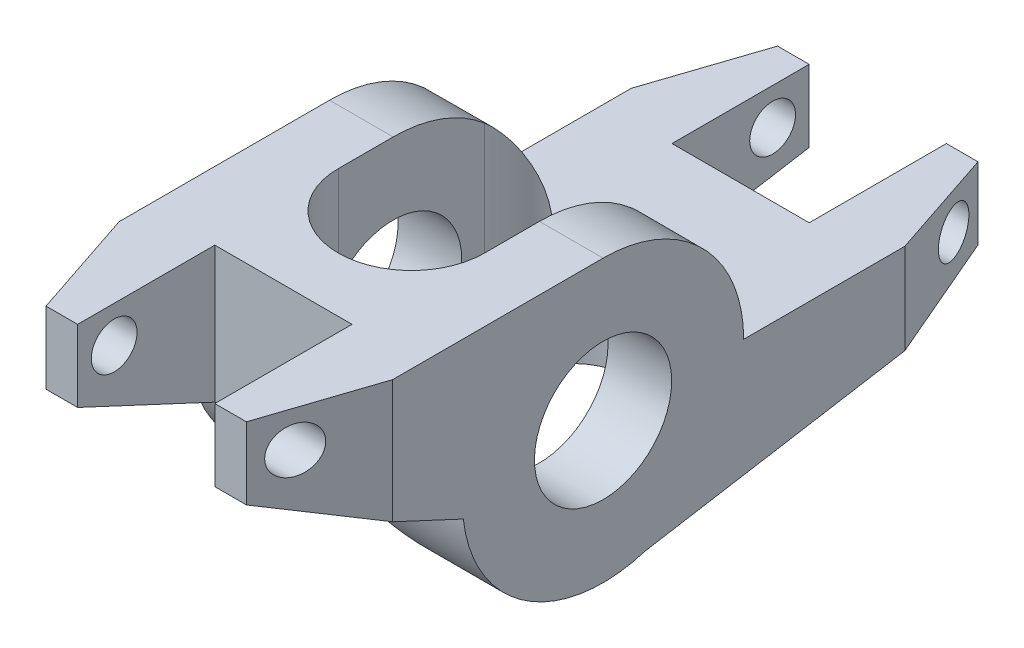
from build123d import *
from OCP.BRepFilletAPI import BRepFilletAPI_MakeChamfer

# Parameters (mm, degrees)
SKETCH1_R               = 4.765
BOSS_EXTRUDE1_DEPTH     = 9.5
CHAMFER1_SIZE           = 2.54
CHAMFER1_SIZE2          = 7.62
CHAMFER2_SIZE           = 7.62
CHAMFER2_SIZE2          = 2.54
CUT_EXTRUDE1_DEPTH      = 32.661042702
CUT_EXTRUDE1_DEPTH_BACK = 32.661042702
CUT_EXTRUDE2_DEPTH      = 32.661042763
CUT_EXTRUDE2_DEPTH_BACK = 32.661042763
SKETCH3_W               = 9.53
SKETCH3_H               = 9.53
CUT_EXTRUDE3_DEPTH      = 32.661042763
CUT_EXTRUDE3_DEPTH_BACK = 32.661042763
SKETCH4_R               = 1.59


with BuildPart() as part:
    # Sketch1 → Boss-Extrude1 (new, symmetric)
    with BuildSketch(Plane(origin=(0, 0, 0), x_dir=(0, 0, -1), z_dir=(1, 0, 0))):
        with BuildLine():
            Line((0, 9.765), (-22.23, 9.765))
            Line((-22.23, 9.765), (-22.23, 4.765))
            Line((-22.23, 4.765), (-9.705624325, -1.075212291))
            ThreePointArc((-9.705624325, -1.075212291), (-5.328833585, -8.182833105), (2.941652472, -9.311385812))
            Line((2.941652472, -9.311385812), (28.58, -5))
            Line((28.58, -5), (28.58, 0))
            Line((28.58, 0), (9.765, 0))
            ThreePointArc((9.765, 0), (6.904897718, 6.904897718), (0, 9.765))
        make_face()
        Circle(SKETCH1_R, mode=Mode.SUBTRACT)
    extrude(amount=BOSS_EXTRUDE1_DEPTH, both=True)

    # Chamfer1: one chamfer whose edges measure the first distance from different faces: ONE call of the kernel's chamfer builder (chamfer() names one face for all edges)
    chamfer1_edges_1 = [part.edges().sort_by_distance(p)[0] for p in [
        (9.5, 7.265, 22.23),
    ]]
    chamfer1_side_1 = [part.faces().sort_by_distance(p)[0] for p in [
        (0, 7.265, 22.23),
    ]]
    chamfer1_edges_2 = [part.edges().sort_by_distance(p)[0] for p in [
        (9.5, -2.5, -28.58),
    ]]
    chamfer1_side_2 = [part.faces().sort_by_distance(p)[0] for p in [
        (0, -2.5, -28.58),
    ]]
    chamfer1 = BRepFilletAPI_MakeChamfer(part.part.solid().wrapped)
    for e in chamfer1_edges_1:
        chamfer1.Add(CHAMFER1_SIZE, CHAMFER1_SIZE2, e.wrapped, chamfer1_side_1[0].wrapped)  # the first distance lies on this face
    for e in chamfer1_edges_2:
        chamfer1.Add(CHAMFER1_SIZE, CHAMFER1_SIZE2, e.wrapped, chamfer1_side_2[0].wrapped)  # the first distance lies on this face
    add(Compound.cast(chamfer1.Shape()), mode=Mode.REPLACE)

    # Chamfer2
    chamfer2_edges = [part.edges().sort_by_distance(p)[0] for p in [
        (-9.5, 7.265, 22.23),
        (-9.5, -2.5, -28.58),
    ]]
    chamfer2_side = [part.faces().sort_by_distance(p)[0] for p in [
        (-9.5, 9.220658471, 11.115),
    ]]
    chamfer(chamfer2_edges, length=CHAMFER2_SIZE, length2=CHAMFER2_SIZE2, reference=chamfer2_side[0])

    # Sketch2 → Cut-Extrude1 (cut, two sides: drawn at the far end of the back side and taken through both)
    with BuildSketch(Plane(origin=(0, 0, 0), x_dir=(1, 0, 0), z_dir=(0, 1, 0)).offset(-CUT_EXTRUDE1_DEPTH_BACK)):
        with BuildLine():
            Line((-5.08, -3.81), (-5.08, 6.35))
            ThreePointArc((-5.08, 6.35), (0, 11.43), (5.08, 6.35))
            Line((5.08, 6.35), (5.08, -3.81))
            ThreePointArc((5.08, -3.81), (0, -8.89), (-5.08, -3.81))
        make_face()
    extrude(amount=CUT_EXTRUDE1_DEPTH + CUT_EXTRUDE1_DEPTH_BACK, mode=Mode.SUBTRACT)

    # Sketch3 → Cut-Extrude2 (cut, two sides: drawn at the far end of the back side and taken through both)
    with BuildSketch(Plane(origin=(0, 0, 0), x_dir=(1, 0, 0), z_dir=(0, 1, 0)).offset(-CUT_EXTRUDE2_DEPTH_BACK)):
        with Locations((0, 23.815)):
            Rectangle(SKETCH3_W, SKETCH3_H)
        with Locations((0, -17.465)):
            Rectangle(SKETCH3_W, SKETCH3_H)
    extrude(amount=CUT_EXTRUDE2_DEPTH + CUT_EXTRUDE2_DEPTH_BACK, mode=Mode.SUBTRACT)

    # Sketch4 → Cut-Extrude3 (cut, two sides: drawn at the far end of the back side and taken through both)
    with BuildSketch(Plane(origin=(0, 0, 0), x_dir=(0, 0, -1), z_dir=(1, 0, 0)).offset(-CUT_EXTRUDE3_DEPTH_BACK)):
        with Locations(Location((-19.69, 7.225, 0), (0, 0, 180))):
            Circle(SKETCH4_R)
        with Locations((26.04, -2.54)):
            Circle(SKETCH4_R)
    extrude(amount=CUT_EXTRUDE3_DEPTH + CUT_EXTRUDE3_DEPTH_BACK, mode=Mode.SUBTRACT)


solid = part.part
